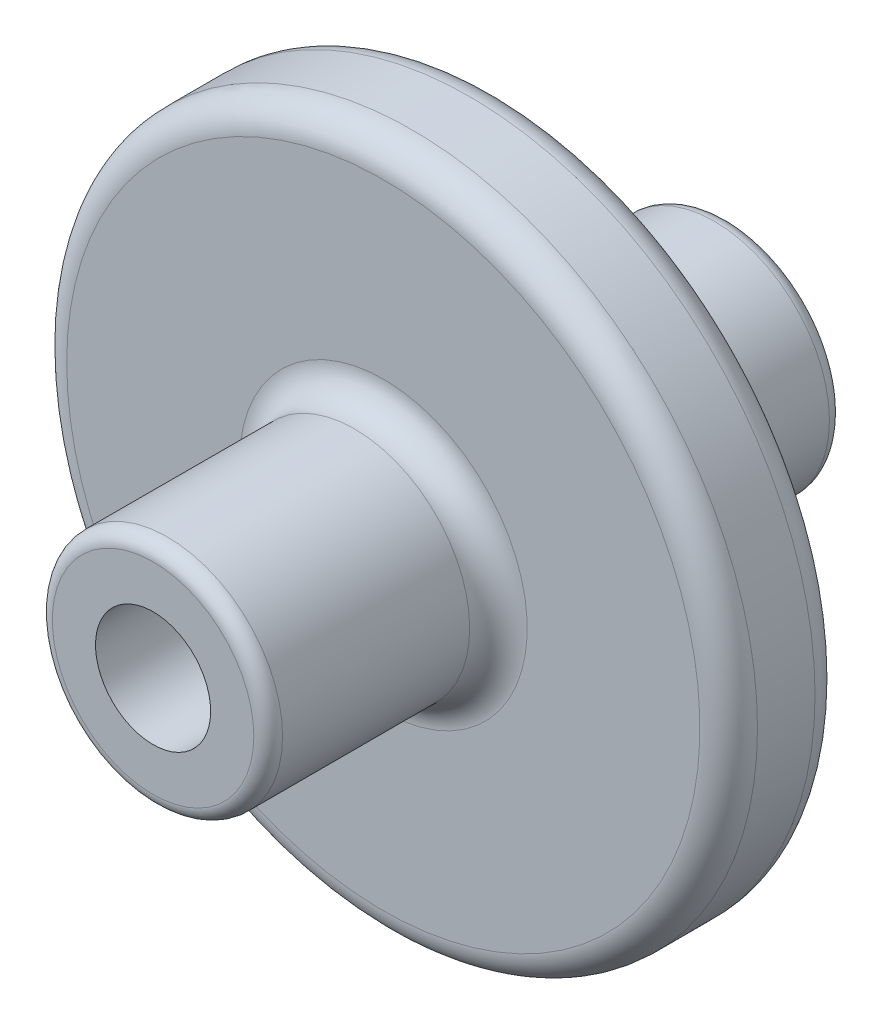
from build123d import *

# Parameters (mm, degrees)
SKETCH1_R           = 3.175
SKETCH1_R_2         = 1.5875
BOSS_EXTRUDE1_DEPTH = 6.35
SKETCH2_R           = 9.525
SKETCH2_R_2         = 1.5875
BOSS_EXTRUDE2_DEPTH = 1.5875
FILLET1_R           = 0.79375
FILLET2_R           = 0.79375
FILLET3_R           = 0.396875


with BuildPart() as part:
    # Sketch1 → Boss-Extrude1 (new body)
    with BuildSketch(Plane.XY):
        Circle(SKETCH1_R)
        Circle(SKETCH1_R_2, mode=Mode.SUBTRACT)
    boss_extrude1 = extrude(amount=-BOSS_EXTRUDE1_DEPTH)

    # Sketch2 → Boss-Extrude2 (add)
    with BuildSketch(Plane(origin=(0, 0, -6.35), x_dir=(-1, 0, 0), z_dir=(0, 0, -1))):
        Circle(SKETCH2_R)
        with Locations(Location((0, 0, 0), (0, 0, 180))):
            Circle(SKETCH2_R_2, mode=Mode.SUBTRACT)
    boss_extrude2 = extrude(amount=BOSS_EXTRUDE2_DEPTH)

    # Mirror1: Boss-Extrude1, Boss-Extrude2 across plane
    add(boss_extrude1.mirror(Plane(origin=(0, 0, -7.9375), x_dir=(1, 0, 0), z_dir=(0, 0, -1))))
    add(boss_extrude2.mirror(Plane(origin=(0, 0, -7.9375), x_dir=(1, 0, 0), z_dir=(0, 0, -1))))

    # Fillet1
    fillet1_edges = [part.edges().sort_by_distance(p)[0] for p in [
        (9.525, 0, -6.35),
        (9.525, 0, -9.525),
    ]]
    fillet(fillet1_edges, radius=FILLET1_R)

    # Fillet2
    fillet2_edges = [part.edges().sort_by_distance(p)[0] for p in [
        (-3.175, 0, -9.525),
        (-3.175, 0, -6.35),
    ]]
    fillet(fillet2_edges, radius=FILLET2_R)

    # Fillet3
    fillet3_edges = [part.edges().sort_by_distance(p)[0] for p in [
        (-3.175, 0, -15.875),
        (-3.175, 0, 0),
    ]]
    fillet(fillet3_edges, radius=FILLET3_R)


solid = part.part
